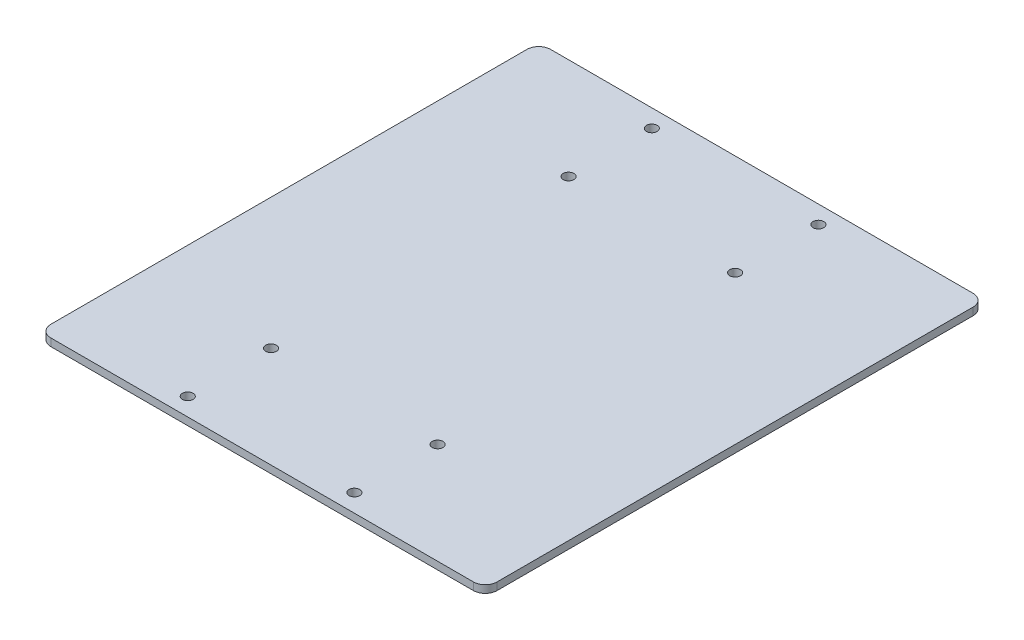
from build123d import *

# Parameters (mm, degrees)
SKETCH1_W            = 375
SKETCH1_H            = 420
BOSS_EXTRUDE1_DEPTH  = 6.35
FILLET1_R            = 10
M8_CLEARANCE_HOLE1_D = 9


with BuildPart() as part:
    # Sketch1 → Boss-Extrude1 (new body)
    with BuildSketch(Plane(origin=(0, 0, 0), x_dir=(1, 0, 0), z_dir=(0, 1, 0))):
        Rectangle(SKETCH1_W, SKETCH1_H)
    extrude(amount=BOSS_EXTRUDE1_DEPTH)

    # Fillet1
    fillet1_edges = [part.edges().sort_by_distance(p)[0] for p in [
        (187.5, 3.175, 210),
        (-187.5, 3.175, 210),
        (-187.5, 3.175, -210),
        (187.5, 3.175, -210),
    ]]
    fillet(fillet1_edges, radius=FILLET1_R)

    # M8 Clearance Hole1 (through all)
    with Locations(Plane(origin=(0, 6.35, 0), x_dir=(1, 0, 0), z_dir=(0, 1, 0))):
        with Locations((-77.5, -195), (62.5, -125), (-77.5, -125), (62.5, -195)):
            m8_clearance_hole1 = Hole(M8_CLEARANCE_HOLE1_D / 2)

    # Mirror1: M8 Clearance Hole1 across plane
    add(m8_clearance_hole1.mirror(Plane.XY), mode=Mode.SUBTRACT)


solid = part.part
